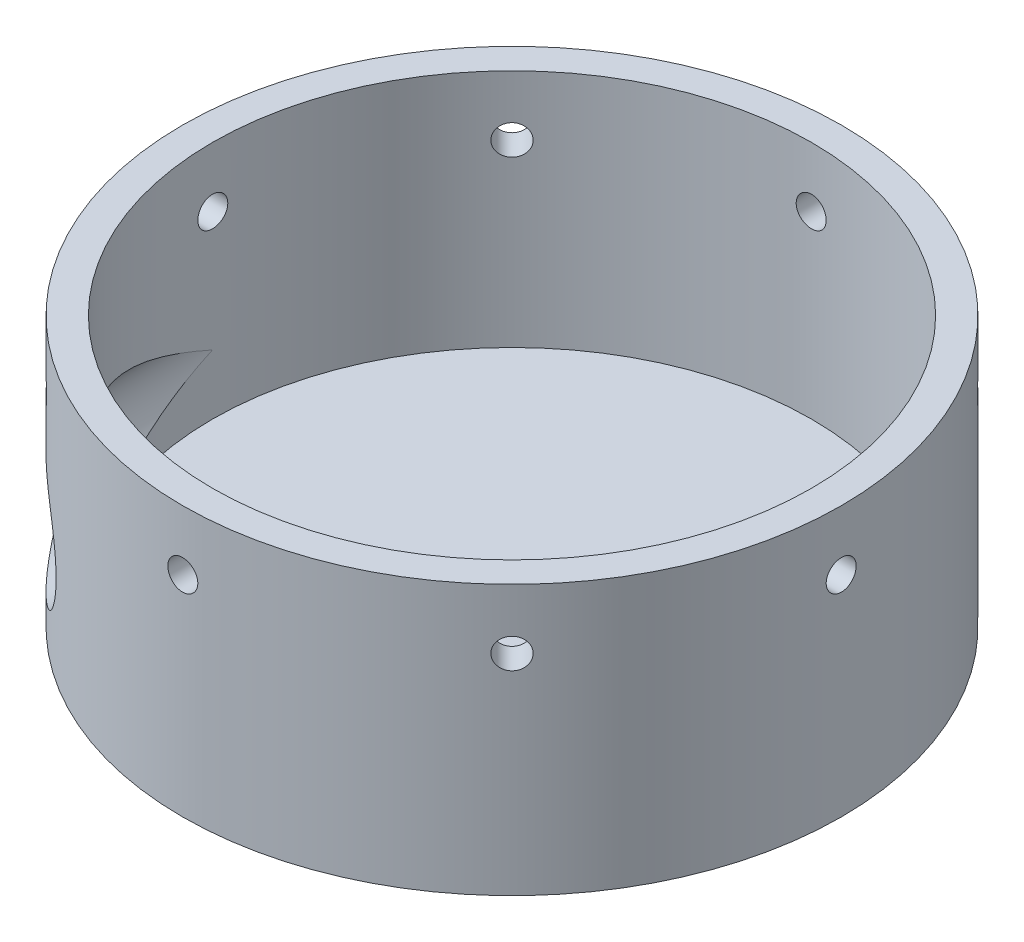
from build123d import *

# Parameters (mm, degrees)
SKETCH2_R          = 3.175
CUT_EXTRUDE1_DEPTH = 115.123474798
CIRPATTERN1_COUNT  = 8
SKETCH3_R          = 12.7
CUT_EXTRUDE2_DEPTH = 115.123474971


with BuildPart() as part:
    # Sketch1 → Revolve1 (revolve)
    with BuildSketch(Plane.XY, mode=Mode.PRIVATE) as revolve1_sk:
        Polygon((6.35, 0), (6.35, 6.35), (63.5, 6.35), (63.5, 57.15), (69.85, 57.15), (69.85, 0), align=None)
    revolve(revolve1_sk.sketch.rotate(Axis((0, 0, 0), (0, 1, 0)), 90), axis=Axis((0, 0, 0), (0, 1, 0)))

    # Sketch2 → Cut-Extrude1 (cut, through all)
    with BuildSketch(Plane.XY):
        with Locations(Location((0, 44.45, 0), (0, 0, 270))):
            Circle(SKETCH2_R)
    cut_extrude1 = extrude(amount=-CUT_EXTRUDE1_DEPTH, mode=Mode.SUBTRACT)

    # CirPattern1: Cut-Extrude1 ×8 about axis
    cirpattern1_axis = Axis((0, 0, 0), (0, -1, 0))
    for i in range(1, CIRPATTERN1_COUNT):
        add(cut_extrude1.rotate(cirpattern1_axis, i * 360 / CIRPATTERN1_COUNT), mode=Mode.SUBTRACT)

    # Sketch3 → Cut-Extrude2 (cut, through all)
    with BuildSketch(Plane.XY):
        with Locations(Location((-50.8, 19.05, 0), (0, 0, 180))):
            Circle(SKETCH3_R)
    extrude(amount=CUT_EXTRUDE2_DEPTH, mode=Mode.SUBTRACT)


solid = part.part
